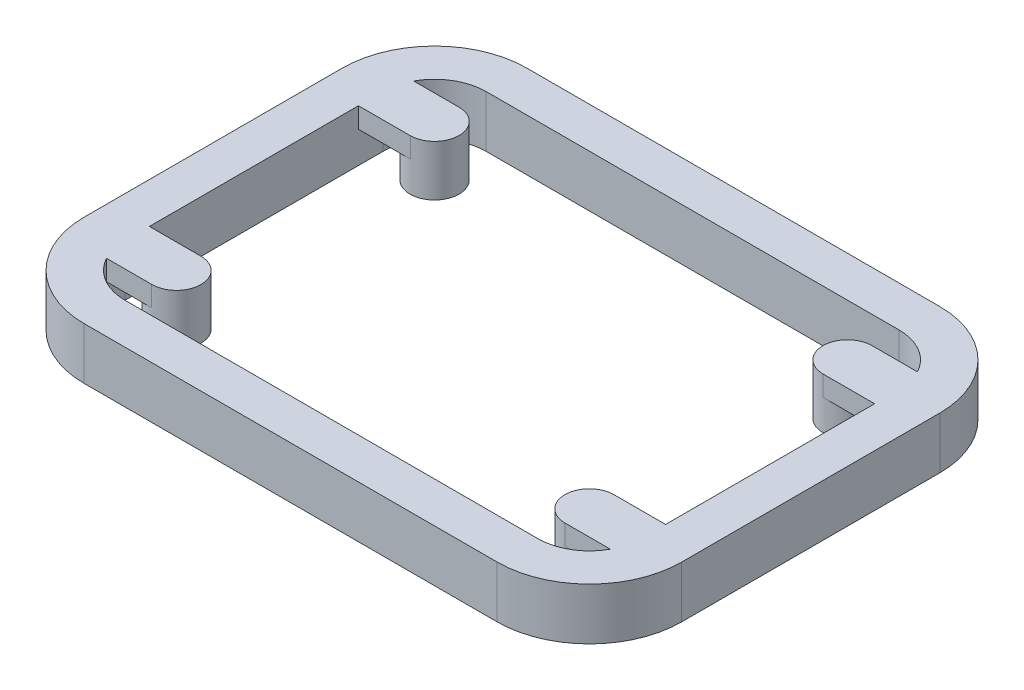
from build123d import *

# Parameters (mm, degrees)
BOSS_EXTRUDE1_DEPTH   = 2.55
SKETCH2_R             = 1.2065
BOSS_EXTRUDE2_DEPTH   = 2.5
BOSS_EXTRUDE2_2_DEPTH = 2.5
BOSS_EXTRUDE2_3_DEPTH = 2.5
BOSS_EXTRUDE2_4_DEPTH = 2.5
SKETCH3_W             = 2.550724021
SKETCH3_H             = 2.413
BOSS_EXTRUDE3_DEPTH   = 1


with BuildPart() as part:
    # Sketch1 → Boss-Extrude1 (new body)
    with BuildSketch(Plane(origin=(0, 0, 0), x_dir=(1, 0, 0), z_dir=(0, 1, 0))):
        with BuildLine():
            Line((-14.7, 6.35), (-14.7, -6.35))
            ThreePointArc((-14.7, -6.35), (-13.370264787, -9.560264787), (-10.16, -10.89))
            Line((-10.16, -10.89), (10.16, -10.89))
            ThreePointArc((10.16, -10.89), (13.370264787, -9.560264787), (14.7, -6.35))
            Line((14.7, -6.35), (14.7, 6.35))
            ThreePointArc((14.7, 6.35), (13.370264787, 9.560264787), (10.16, 10.89))
            Line((10.16, 10.89), (-10.16, 10.89))
            ThreePointArc((-10.16, 10.89), (-13.370264787, 9.560264787), (-14.7, 6.35))
        make_face()
        with BuildLine():
            Line((-10.16, 8.89), (10.16, 8.89))
            ThreePointArc((10.16, 8.89), (11.956051224, 8.146051224), (12.7, 6.35))
            Line((12.7, 6.35), (12.7, -6.35))
            ThreePointArc((12.7, -6.35), (11.956051224, -8.146051224), (10.16, -8.89))
            Line((10.16, -8.89), (-10.16, -8.89))
            ThreePointArc((-10.16, -8.89), (-11.956051224, -8.146051224), (-12.7, -6.35))
            Line((-12.7, -6.35), (-12.7, 6.35))
            ThreePointArc((-12.7, 6.35), (-11.956051224, 8.146051224), (-10.16, 8.89))
        make_face(mode=Mode.SUBTRACT)
    extrude(amount=BOSS_EXTRUDE1_DEPTH)



with BuildPart() as body_2:
    # Sketch2 → Boss-Extrude2 (new body)
    with BuildSketch(Plane(origin=(0, 2.55, 0), x_dir=(1, 0, 0), z_dir=(0, 1, 0))):
        with Locations(Location((10.16, 6.35, 0), (0, 0, 270))):
            Circle(SKETCH2_R)
    extrude(amount=-BOSS_EXTRUDE2_DEPTH)


with BuildPart() as body_3:
    # Sketch2 → Boss-Extrude2 2 (new body)
    with BuildSketch(Plane(origin=(0, 2.55, 0), x_dir=(1, 0, 0), z_dir=(0, 1, 0))):
        with Locations(Location((-10.16, 6.35, 0), (0, 0, 270))):
            Circle(SKETCH2_R)
    extrude(amount=-BOSS_EXTRUDE2_2_DEPTH)


with BuildPart() as body_4:
    # Sketch2 → Boss-Extrude2 3 (new body)
    with BuildSketch(Plane(origin=(0, 2.55, 0), x_dir=(1, 0, 0), z_dir=(0, 1, 0))):
        with Locations(Location((-10.16, -6.35, 0), (0, 0, 270))):
            Circle(SKETCH2_R)
    extrude(amount=-BOSS_EXTRUDE2_3_DEPTH)


with BuildPart() as body_5:
    # Sketch2 → Boss-Extrude2 4 (new body)
    with BuildSketch(Plane(origin=(0, 2.55, 0), x_dir=(1, 0, 0), z_dir=(0, 1, 0))):
        with Locations(Location((10.16, -6.35, 0), (0, 0, 270))):
            Circle(SKETCH2_R)
    extrude(amount=-BOSS_EXTRUDE2_4_DEPTH)


with BuildPart() as part_1:
    add(part.part)

    add(body_2.part)  # Boss-Extrude3 merges body 2

    add(body_3.part)  # Boss-Extrude3 merges body 3

    add(body_4.part)  # Boss-Extrude3 merges body 4

    add(body_5.part)  # Boss-Extrude3 merges body 5
    # Sketch3 → Boss-Extrude3 (add)
    with BuildSketch(Plane(origin=(0, 2.55, 0), x_dir=(1, 0, 0), z_dir=(0, 1, 0))):
        with Locations((-11.42463799, 6.349952339)):
            Rectangle(SKETCH3_W, SKETCH3_H)
        with Locations((11.42463799, 6.349952339)):
            Rectangle(SKETCH3_W, SKETCH3_H)
        with Locations((11.42463799, -6.349952339)):
            Rectangle(SKETCH3_W, SKETCH3_H)
        with Locations((-11.42463799, -6.349952339)):
            Rectangle(SKETCH3_W, SKETCH3_H)
    extrude(amount=-BOSS_EXTRUDE3_DEPTH)


solid = part_1.part
